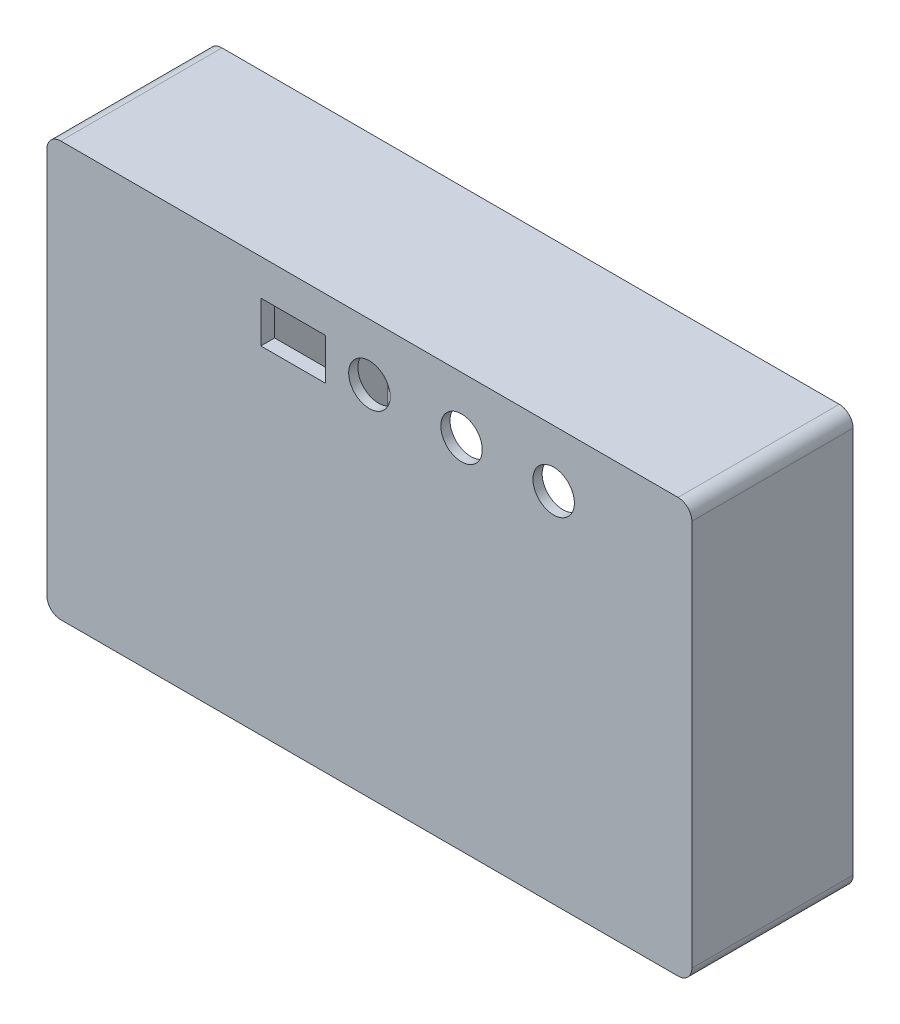
from build123d import *

# Parameters (mm, degrees)
EXTRUDE_2_DEPTH     = 35
CUT_EXTRUDE_3_DEPTH = 5
CUT_EXTRUDE_4_DEPTH = 27
CUT_EXTRUDE_5_DEPTH = 2
CUT_EXTRUDE_6_DEPTH = 1
SKETCH_10_R         = 4.5
CUT_EXTRUDE_7_DEPTH = 2
SKETCH_11_W         = 35
SKETCH_11_H         = 15
SKETCH_11_W_2       = 28
SKETCH_11_H_2       = 12
EXTRUDE_3_DEPTH     = 5
EXTRUDE_5_DEPTH     = 26
SKETCH_13_W         = 14
SKETCH_13_H         = 9
CUT_EXTRUDE_8_DEPTH = 3


with BuildPart() as part:
    # 草图4 → 凸台-拉伸2 (new body)
    with BuildSketch(Plane.XY):
        with BuildLine():
            Line((67, 0), (-67, 0))
            ThreePointArc((-67, 0), (-69.121320344, 0.878679656), (-70, 3))
            Line((-70, 3), (-70, 87))
            ThreePointArc((-70, 87), (-69.121320344, 89.121320344), (-67, 90))
            Line((-67, 90), (67, 90))
            ThreePointArc((67, 90), (69.121320344, 89.121320344), (70, 87))
            Line((70, 87), (70, 3))
            ThreePointArc((70, 3), (69.121320344, 0.878679656), (67, 0))
        make_face()
    extrude(amount=-EXTRUDE_2_DEPTH)

    # 草图5 → 切除-拉伸3 (cut)
    with BuildSketch(Plane(origin=(0, 0, -35), x_dir=(-1, 0, 0), z_dir=(0, 0, -1))):
        with BuildLine():
            Line((-64.5, 87.5), (64.5, 87.5))
            ThreePointArc((64.5, 87.5), (66.621320344, 86.621320344), (67.5, 84.5))
            Line((67.5, 84.5), (67.5, 5.5))
            ThreePointArc((67.5, 5.5), (66.621320344, 3.378679656), (64.5, 2.5))
            Line((64.5, 2.5), (-64.5, 2.5))
            ThreePointArc((-64.5, 2.5), (-66.621320344, 3.378679656), (-67.5, 5.5))
            Line((-67.5, 5.5), (-67.5, 84.5))
            ThreePointArc((-67.5, 84.5), (-66.621320344, 86.621320344), (-64.5, 87.5))
        make_face()
    extrude(amount=-CUT_EXTRUDE_3_DEPTH, mode=Mode.SUBTRACT)

    # 草图7 → 切除-拉伸4 (cut)
    with BuildSketch(Plane(origin=(0, 0, -30), x_dir=(-1, 0, 0), z_dir=(0, 0, -1))):
        with BuildLine():
            Line((62, 5), (65, 5))
            Line((65, 5), (65, 8))
            Line((65, 8), (65, 82))
            ThreePointArc((65, 82), (64.121320344, 84.121320344), (62, 85))
            Line((62, 85), (-62, 85))
            ThreePointArc((-62, 85), (-64.121320344, 84.121320344), (-65, 82))
            Line((-65, 82), (-65, 8))
            ThreePointArc((-65, 8), (-64.121320344, 5.878679656), (-62, 5))
            Line((-62, 5), (62, 5))
        make_face()
    extrude(amount=-CUT_EXTRUDE_4_DEPTH, mode=Mode.SUBTRACT)

    # 草图8 → 切除-拉伸5 (cut)
    with BuildSketch(Plane(origin=(0, 0, -3), x_dir=(-1, 0, 0), z_dir=(0, 0, -1))):
        Polygon((-58.354551733, 12.85), (-56.709103466, 10), (-58.354551733, 7.15), (-61.645448267, 7.15), (-63.290896534, 10), (-61.645448267, 12.85), align=None)
        Polygon((-56.709103466, 80), (-58.354551733, 82.85), (-61.645448267, 82.85), (-63.290896534, 80), (-61.645448267, 77.15), (-58.354551733, 77.15), align=None)
        Polygon((17.760008931, 68.924519398), (16.458678386, 71.17849002), (13.856017295, 71.17849002), (12.554686749, 68.924519398), (13.856017295, 66.670548775), (16.458678386, 66.670548775), align=None)
        Polygon((-52.143982702, 66.670548775), (-53.445313247, 68.924519398), (-52.143982702, 71.17849002), (-49.541321611, 71.17849002), (-48.239991065, 68.924519398), (-49.541321611, 66.670548775), align=None)
        Polygon((58.354551733, 77.15), (56.709103466, 80), (58.354551733, 82.85), (61.645448267, 82.85), (63.290896534, 80), (61.645448267, 77.15), align=None)
        Polygon((8.354551733, 7.15), (6.709103466, 10), (8.354551733, 12.85), (11.645448267, 12.85), (13.290896534, 10), (11.645448267, 7.15), align=None)
        Polygon((-49.541321611, 25.17849002), (-52.143982702, 25.17849002), (-53.445313247, 22.924519398), (-52.143982702, 20.670548775), (-49.541321611, 20.670548775), (-48.239991065, 22.924519398), align=None)
        Polygon((16.458678386, 25.17849002), (17.760008931, 22.924519398), (16.458678386, 20.670548775), (13.856017295, 20.670548775), (12.554686749, 22.924519398), (13.856017295, 25.17849002), align=None)
    extrude(amount=-CUT_EXTRUDE_5_DEPTH, mode=Mode.SUBTRACT)

    # 草图9 → 切除-拉伸6 (cut)
    with BuildSketch(Plane(origin=(0, 0, -3), x_dir=(-1, 0, 0), z_dir=(0, 0, -1))):
        Polygon((-13.07179677, 77.685248672), (-16.535898385, 83.685248672), (-23.464101615, 83.685248672), (-26.92820323, 77.685248672), (-23.464101615, 71.685248672), (-16.535898385, 71.685248672), align=None)
        Polygon((-33.07179677, 77.685248672), (-36.535898385, 83.685248672), (-43.464101615, 83.685248672), (-46.92820323, 77.685248672), (-43.464101615, 71.685248672), (-36.535898385, 71.685248672), align=None)
        Polygon((6.92820323, 77.685248672), (3.464101615, 83.685248672), (-3.464101615, 83.685248672), (-6.92820323, 77.685248672), (-3.464101615, 71.685248672), (3.464101615, 71.685248672), align=None)
    extrude(amount=-CUT_EXTRUDE_6_DEPTH, mode=Mode.SUBTRACT)

    # 草图10 → 切除-拉伸7 (cut)
    with BuildSketch(Plane(origin=(0, 0, -2), x_dir=(-1, 0, 0), z_dir=(0, 0, -1))):
        with Locations((-40, 77.685248672)):
            Circle(SKETCH_10_R)
        with Locations((-20, 77.685248672)):
            Circle(SKETCH_10_R)
        with Locations((0, 77.685248672)):
            Circle(SKETCH_10_R)
    extrude(amount=-CUT_EXTRUDE_7_DEPTH, mode=Mode.SUBTRACT)

    # 草图11 → 凸台-拉伸3 (add)
    with BuildSketch(Plane(origin=(0, 0, -3), x_dir=(-1, 0, 0), z_dir=(0, 0, -1))):
        with Locations((47.5, 65.5)):
            Rectangle(SKETCH_11_W, SKETCH_11_H)
        with Locations((44, 11)):
            Rectangle(SKETCH_11_W_2, SKETCH_11_H_2)
        with Locations((47.5, 40.037281602)):
            Rectangle(SKETCH_11_W, SKETCH_11_H)
    extrude(amount=EXTRUDE_3_DEPTH)

    # 草图12 → 凸台-拉伸5 (add)
    with BuildSketch(Plane(origin=(0, 0, -3), x_dir=(-1, 0, 0), z_dir=(0, 0, -1))):
        Polygon((30, 73), (30, 5), (25, 5), (25, 73), (25, 78), (43, 78), (43, 73), align=None)
    extrude(amount=EXTRUDE_5_DEPTH)

    # 草图13 → 切除-拉伸8 (cut)
    with BuildSketch(Plane(origin=(0, 0, -3), x_dir=(-1, 0, 0), z_dir=(0, 0, -1))):
        with Locations((16.566160231, 77.685248672)):
            Rectangle(SKETCH_13_W, SKETCH_13_H)
    extrude(amount=-CUT_EXTRUDE_8_DEPTH, mode=Mode.SUBTRACT)


solid = part.part
